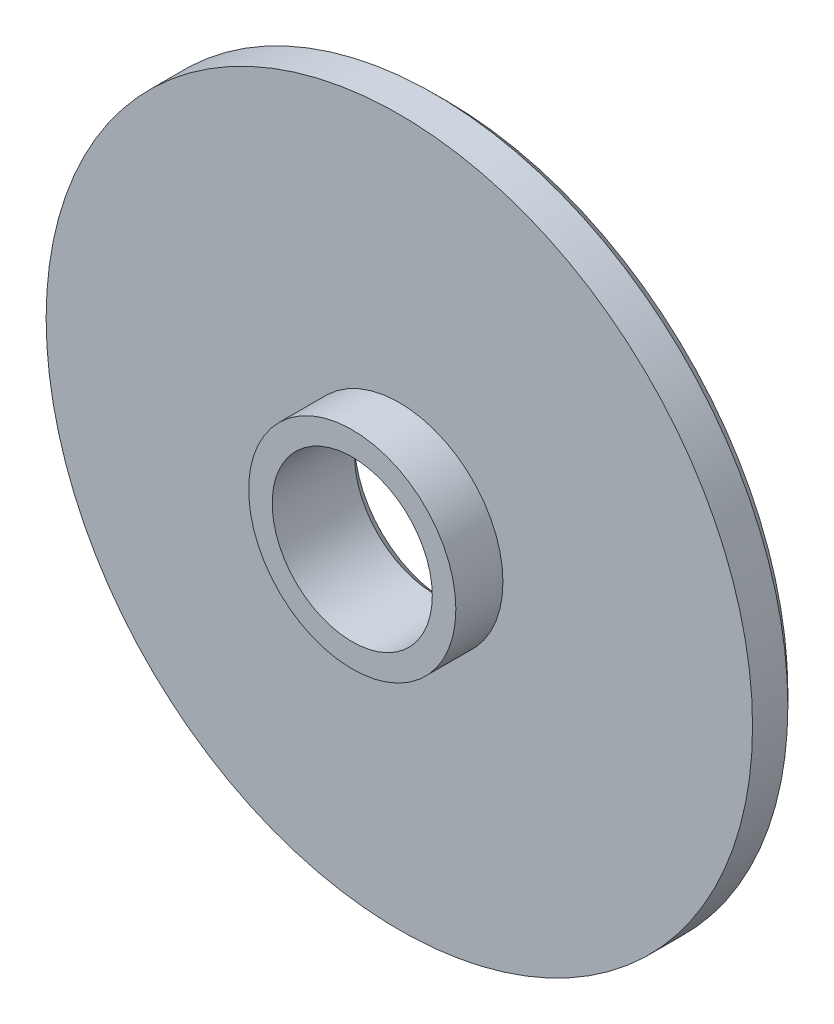
from build123d import *

# Parameters (mm, degrees)
SKETCH1_R           = 7.5
SKETCH1_R_2         = 1.7
BOSS_EXTRUDE1_DEPTH = 1
SKETCH2_R           = 2.2
SKETCH2_R_2         = 1.7
BOSS_EXTRUDE2_DEPTH = 1
CHAMFER1_SIZE       = 0.25


with BuildPart() as part:
    # Sketch1 → Boss-Extrude1 (new body)
    with BuildSketch(Plane.XY):
        Circle(SKETCH1_R)
        Circle(SKETCH1_R_2, mode=Mode.SUBTRACT)
    extrude(amount=BOSS_EXTRUDE1_DEPTH)

    # Sketch2 → Boss-Extrude2 (add)
    with BuildSketch(Plane.XY.offset(1)):
        Circle(SKETCH2_R)
        Circle(SKETCH2_R_2, mode=Mode.SUBTRACT)
    extrude(amount=BOSS_EXTRUDE2_DEPTH)

    # Chamfer1
    chamfer1_edges = [part.edges().sort_by_distance(p)[0] for p in [
        (-7.5, 0, 0),
        (-1.7, 0, 0),
    ]]
    chamfer(chamfer1_edges, length=CHAMFER1_SIZE)


solid = part.part
